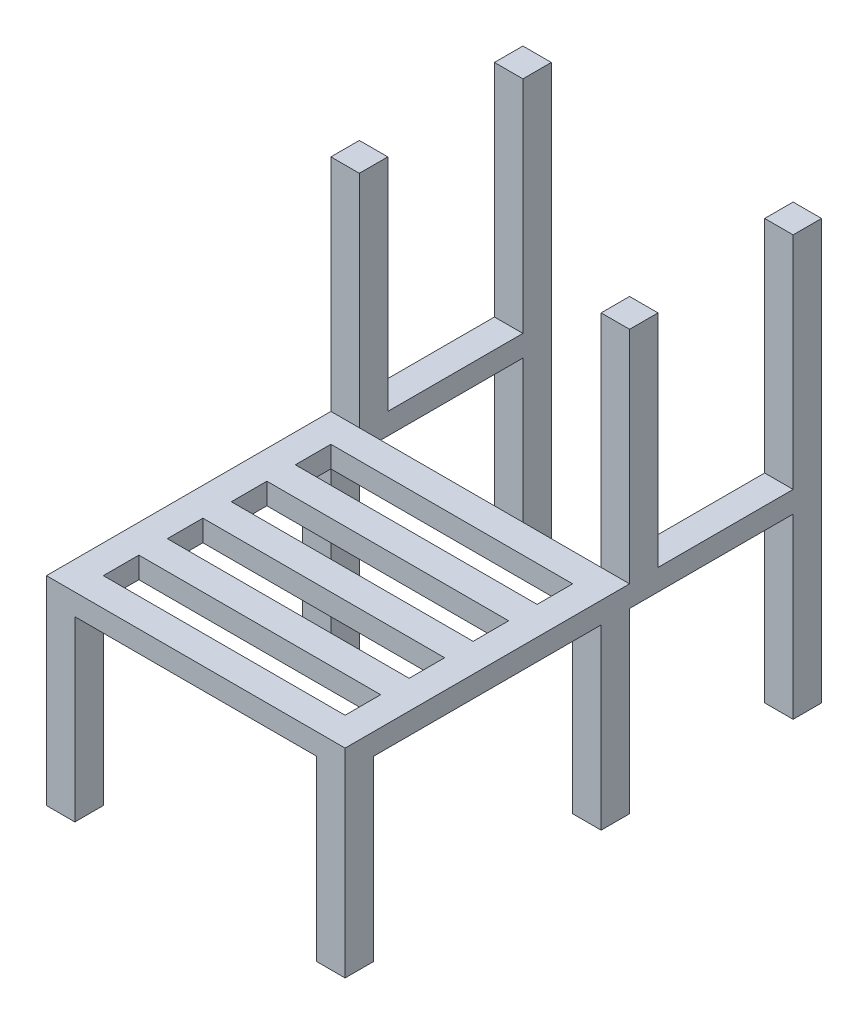
from build123d import *

# Parameters (mm, degrees)
SKETCH1_W             = 40
SKETCH1_H             = 30
BOSS_EXTRUDE1_DEPTH   = 400
BOSS_EXTRUDE1_2_DEPTH = 400
BOSS_EXTRUDE2_REACH   = 553.928
SKETCH2_W             = 40
SKETCH2_H             = 30
SKETCH3_W             = 40
SKETCH3_H             = 40
BOSS_EXTRUDE3_DEPTH   = 250
SKETCH4_W             = 40
SKETCH4_H             = 30
BOSS_EXTRUDE4_DEPTH   = 270
SKETCH5_W             = 40
SKETCH5_H             = 40
BOSS_EXTRUDE5_DEPTH   = 250
SKETCH6_W             = 40
SKETCH6_H             = 40
BOSS_EXTRUDE6_DEPTH   = 310


with BuildPart() as part:
    # Sketch1 → Boss-Extrude1 (new body)
    with BuildSketch(Plane.XY):
        Rectangle(SKETCH1_W, SKETCH1_H)
    extrude(amount=BOSS_EXTRUDE1_DEPTH)


with BuildPart() as body_2:
    # Sketch1 → Boss-Extrude1 2 (new body)
    with BuildSketch(Plane.XY):
        with Locations((380, 0)):
            Rectangle(SKETCH1_W, SKETCH1_H)
    extrude(amount=BOSS_EXTRUDE1_2_DEPTH)

    # Sketch2 → Boss-Extrude2 (add, up to next)
    with BuildSketch(Plane(origin=(20, 0, 0), x_dir=(0, 0, -1), z_dir=(1, 0, 0)), mode=Mode.PRIVATE) as boss_extrude2_sk1:
        with Locations((-380, 0)):
            Rectangle(SKETCH2_W, SKETCH2_H)
    boss_extrude2_tool1 = extrude(boss_extrude2_sk1.sketch, amount=BOSS_EXTRUDE2_REACH, mode=Mode.PRIVATE) - body_2.part
    # Sketch2 → Boss-Extrude2 (add, up to next)
    with BuildSketch(Plane(origin=(20, 0, 0), x_dir=(0, 0, -1), z_dir=(1, 0, 0)), mode=Mode.PRIVATE) as boss_extrude2_sk2:
        with Locations((-290, 0)):
            Rectangle(SKETCH2_W, SKETCH2_H)
    boss_extrude2_tool2 = extrude(boss_extrude2_sk2.sketch, amount=BOSS_EXTRUDE2_REACH, mode=Mode.PRIVATE) - body_2.part
    # Sketch2 → Boss-Extrude2 (add, up to next)
    with BuildSketch(Plane(origin=(20, 0, 0), x_dir=(0, 0, -1), z_dir=(1, 0, 0)), mode=Mode.PRIVATE) as boss_extrude2_sk3:
        with Locations((-110, 0)):
            Rectangle(SKETCH2_W, SKETCH2_H)
    boss_extrude2_tool3 = extrude(boss_extrude2_sk3.sketch, amount=BOSS_EXTRUDE2_REACH, mode=Mode.PRIVATE) - body_2.part
    # Sketch2 → Boss-Extrude2 (add, up to next)
    with BuildSketch(Plane(origin=(20, 0, 0), x_dir=(0, 0, -1), z_dir=(1, 0, 0)), mode=Mode.PRIVATE) as boss_extrude2_sk4:
        with Locations((-20, 0)):
            Rectangle(SKETCH2_W, SKETCH2_H)
    boss_extrude2_tool4 = extrude(boss_extrude2_sk4.sketch, amount=BOSS_EXTRUDE2_REACH, mode=Mode.PRIVATE) - body_2.part
    # Sketch2 → Boss-Extrude2 (add, up to next)
    with BuildSketch(Plane(origin=(20, 0, 0), x_dir=(0, 0, -1), z_dir=(1, 0, 0)), mode=Mode.PRIVATE) as boss_extrude2_sk5:
        with Locations((-200, 0)):
            Rectangle(SKETCH2_W, SKETCH2_H)
    boss_extrude2_tool5 = extrude(boss_extrude2_sk5.sketch, amount=BOSS_EXTRUDE2_REACH, mode=Mode.PRIVATE) - body_2.part

    add(part.part)  # Boss-Extrude2 merges part
    add(boss_extrude2_tool1.solids().sort_by_distance((20, 0, 380))[0])
    add(boss_extrude2_tool2.solids().sort_by_distance((20, 0, 290))[0])
    add(boss_extrude2_tool3.solids().sort_by_distance((20, 0, 110))[0])
    add(boss_extrude2_tool4.solids().sort_by_distance((20, 0, 20))[0])
    add(boss_extrude2_tool5.solids().sort_by_distance((20, 0, 200))[0])

    # Sketch3 → Boss-Extrude3 (add)
    with BuildSketch(Plane.XZ.offset(15)):
        with Locations((0, 380)):
            Rectangle(SKETCH3_W, SKETCH3_H)
        with Locations((0, 20)):
            Rectangle(SKETCH3_W, SKETCH3_H)
        with Locations((380, 380)):
            Rectangle(SKETCH3_W, SKETCH3_H)
        with Locations((380, 20)):
            Rectangle(SKETCH3_W, SKETCH3_H)
    extrude(amount=BOSS_EXTRUDE3_DEPTH)

    # Sketch4 → Boss-Extrude4 (add)
    with BuildSketch(Plane(origin=(0, 0, 0), x_dir=(-1, 0, 0), z_dir=(0, 0, -1))):
        with Locations((-380, 0)):
            Rectangle(SKETCH4_W, SKETCH4_H)
        Rectangle(SKETCH4_W, SKETCH4_H)
    extrude(amount=BOSS_EXTRUDE4_DEPTH)

    # Sketch5 → Boss-Extrude5 (add)
    with BuildSketch(Plane.XZ.offset(15)):
        with Locations((0, -250)):
            Rectangle(SKETCH5_W, SKETCH5_H)
        with Locations((380, -250)):
            Rectangle(SKETCH5_W, SKETCH5_H)
    extrude(amount=BOSS_EXTRUDE5_DEPTH)

    # Sketch6 → Boss-Extrude6 (add)
    with BuildSketch(Plane(origin=(0, 15, 0), x_dir=(1, 0, 0), z_dir=(0, 1, 0))):
        with Locations((0, 250)):
            Rectangle(SKETCH6_W, SKETCH6_H)
        with Locations((380, 250)):
            Rectangle(SKETCH6_W, SKETCH6_H)
        with Locations((0, 20)):
            Rectangle(SKETCH6_W, SKETCH6_H)
        with Locations((380, 20)):
            Rectangle(SKETCH6_W, SKETCH6_H)
    extrude(amount=BOSS_EXTRUDE6_DEPTH)


solid = body_2.part
